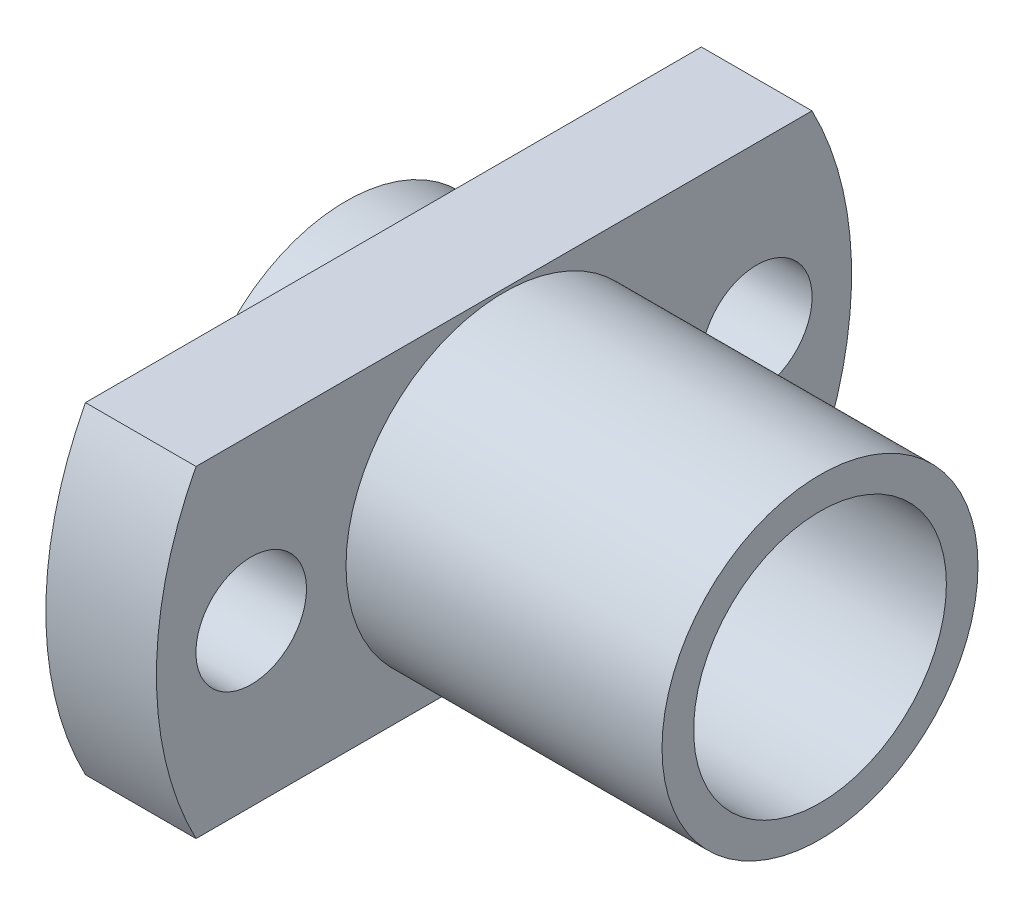
from build123d import *

# Parameters (mm, degrees)
SKETCH_1_R      = 5
SKETCH_1_R_2    = 4
EXTRUDE_1_DEPTH = 1.5
SKETCH_2_R      = 4
SKETCH_2_R_2    = 1.75
EXTRUDE_2_DEPTH = 3.5
SKETCH_3_R      = 5
SKETCH_3_R_2    = 4
EXTRUDE_3_DEPTH = 10


with BuildPart() as part:
    # 草图1 → 凸台-拉伸1 (new body)
    with BuildSketch(Plane(origin=(0, 0, 0), x_dir=(0, 0, -1), z_dir=(1, 0, 0))):
        Circle(SKETCH_1_R)
        Circle(SKETCH_1_R_2, mode=Mode.SUBTRACT)
    extrude(amount=EXTRUDE_1_DEPTH)

    # 草图2 → 凸台-拉伸2 (add)
    with BuildSketch(Plane(origin=(1.5, 0, 0), x_dir=(0, 0, -1), z_dir=(1, 0, 0))):
        with BuildLine():
            Line((-9.746281342, 5.1), (9.746281342, 5.1))
            ThreePointArc((9.746281342, 5.1), (11, 0), (9.746281342, -5.1))
            Line((9.746281342, -5.1), (-9.746281342, -5.1))
            ThreePointArc((-9.746281342, -5.1), (-11, 0), (-9.746281342, 5.1))
        make_face()
        Circle(SKETCH_2_R, mode=Mode.SUBTRACT)
        with Locations((-8, 0)):
            Circle(SKETCH_2_R_2, mode=Mode.SUBTRACT)
        with Locations((8, 0)):
            Circle(SKETCH_2_R_2, mode=Mode.SUBTRACT)
    extrude(amount=EXTRUDE_2_DEPTH)

    # 草图3 → 凸台-拉伸3 (add)
    with BuildSketch(Plane(origin=(5, 0, 0), x_dir=(0, 0, -1), z_dir=(1, 0, 0))):
        Circle(SKETCH_3_R)
        Circle(SKETCH_3_R_2, mode=Mode.SUBTRACT)
    extrude(amount=EXTRUDE_3_DEPTH)


solid = part.part
